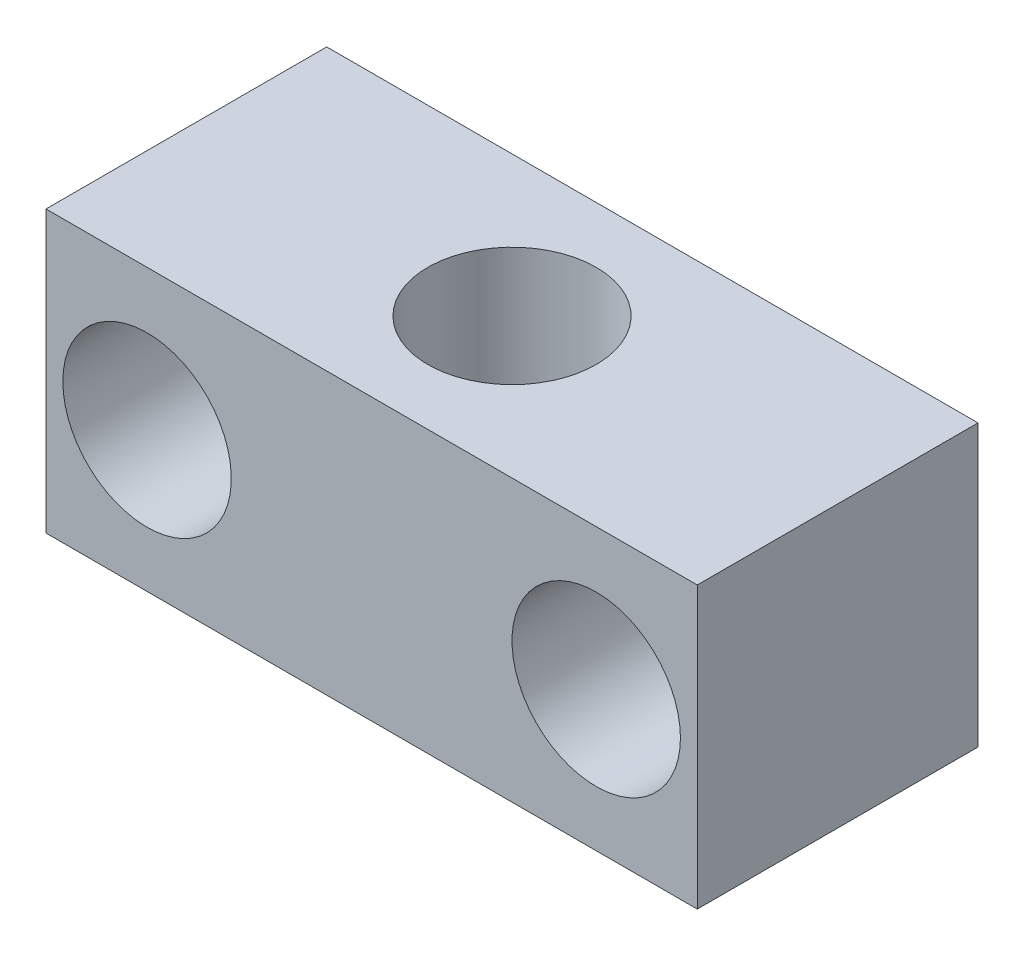
from build123d import *

# Parameters (mm, degrees)
SKETCH1_W           = 12
SKETCH1_H           = 5
BOSS_EXTRUDE1_DEPTH = 5
SKETCH2_R           = 1.5
CUT_EXTRUDE1_DEPTH  = 15.335059136
SKETCH3_R           = 1.5
CUT_EXTRUDE2_DEPTH  = 14.87695255
MOVE_FACE1_BY       = 0.2
MOVE_FACE1_2_BY     = 0.2


with BuildPart() as part:
    # Sketch1 → Boss-Extrude1 (new body)
    with BuildSketch(Plane.XY):
        with Locations((-6.469720142, -0.975038364)):
            Rectangle(SKETCH1_W, SKETCH1_H)
    extrude(amount=BOSS_EXTRUDE1_DEPTH)

    # Sketch2 → Cut-Extrude1 (cut, through all)
    with BuildSketch(Plane.XZ.offset(3.475038364)):
        with Locations(Location((-6.469720142, 2.5, 0), (0, 0, 270))):
            Circle(SKETCH2_R)
    extrude(amount=-CUT_EXTRUDE1_DEPTH, mode=Mode.SUBTRACT)

    # Sketch3 → Cut-Extrude2 (cut, through all)
    with BuildSketch(Plane(origin=(0, 0, 0), x_dir=(-1, 0, 0), z_dir=(0, 0, -1))):
        with Locations((10.469720142, -0.98443785)):
            Circle(SKETCH3_R)
        with Locations(Location((2.469720142, -0.98443785, 0), (0, 0, 180))):
            Circle(SKETCH3_R)
    extrude(amount=-CUT_EXTRUDE2_DEPTH, mode=Mode.SUBTRACT)

    # Move Face1: a face moved inward by 0.2
    extrude(part.faces().sort_by_distance((-0.469720142, -0.975038364, 2.5))[0], amount=MOVE_FACE1_BY, dir=(-1, 0, 0), mode=Mode.SUBTRACT)

    # Move Face1 2: a face moved inward by 0.2
    extrude(part.faces().sort_by_distance((-12.469720142, -0.975038364, 2.5))[0], amount=MOVE_FACE1_2_BY, dir=(1, 0, 0), mode=Mode.SUBTRACT)


solid = part.part
